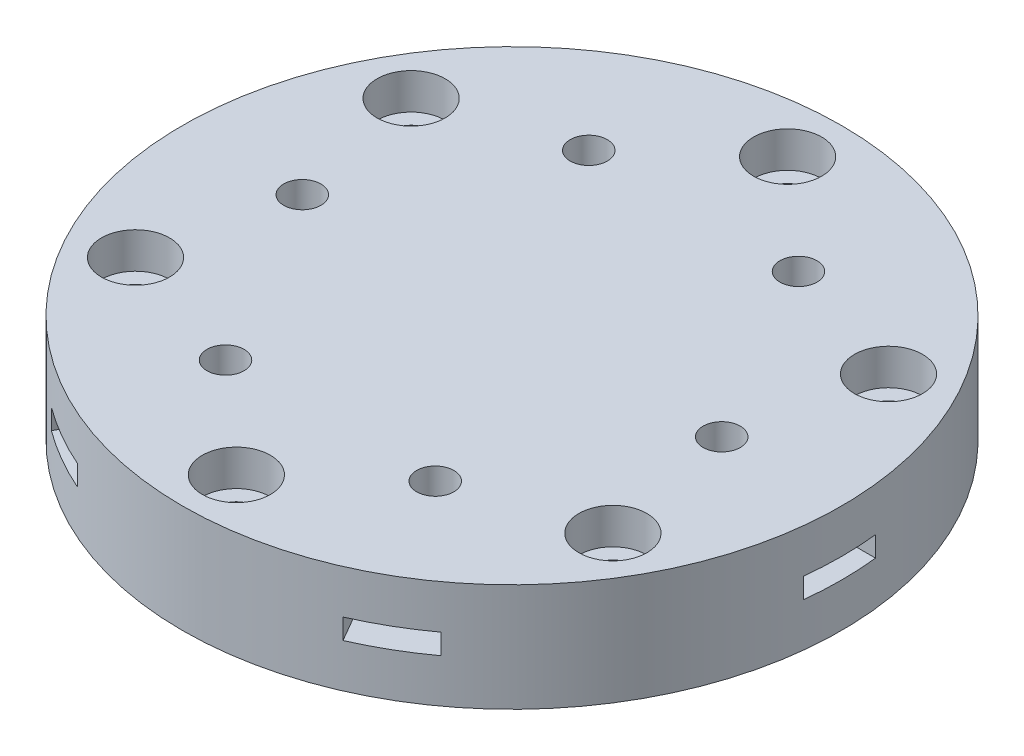
from build123d import *

# Parameters (mm, degrees)
SKETCH1_R           = 27.5
SKETCH1_R_2         = 1.5
BOSS_EXTRUDE1_DEPTH = 9
CUT_EXTRUDE1_START  = -3
SKETCH2_R           = 2.84
SKETCH2_R_2         = 1.5
CUT_EXTRUDE1_DEPTH  = 3
CUT_EXTRUDE2_DEPTH  = 0.85
CUT_EXTRUDE3_REACH  = 41.919
SKETCH5_R           = 1.55


with BuildPart() as part:
    # Sketch1 → Boss-Extrude1 (new body)
    with BuildSketch(Plane(origin=(0, 0, 0), x_dir=(1, 0, 0), z_dir=(0, 1, 0))):
        with Locations(Location((0, 0, 0), (0, 0, 270))):
            Circle(SKETCH1_R)
        with Locations(Location((0, 23, 0), (0, 0, 270))):
            Circle(SKETCH1_R_2, mode=Mode.SUBTRACT)
        with Locations(Location((19.918584287, 11.5, 0), (0, 0, 270))):
            Circle(SKETCH1_R_2, mode=Mode.SUBTRACT)
        with Locations(Location((19.918584287, -11.5, 0), (0, 0, 270))):
            Circle(SKETCH1_R_2, mode=Mode.SUBTRACT)
        with Locations(Location((0, -23, 0), (0, 0, 270))):
            Circle(SKETCH1_R_2, mode=Mode.SUBTRACT)
        with Locations(Location((-19.918584287, -11.5, 0), (0, 0, 270))):
            Circle(SKETCH1_R_2, mode=Mode.SUBTRACT)
        with Locations(Location((-19.918584287, 11.5, 0), (0, 0, 270))):
            Circle(SKETCH1_R_2, mode=Mode.SUBTRACT)
    extrude(amount=BOSS_EXTRUDE1_DEPTH)

    # Sketch2 → Cut-Extrude1 (cut)
    # profile 1 of 6: a face of its own
    with BuildSketch(Plane(origin=(0, 9, 0), x_dir=(1, 0, 0), z_dir=(0, 1, 0)).offset(CUT_EXTRUDE1_START)):
        with Locations(Location((0, -23, 0), (0, 0, 270))):
            Circle(SKETCH2_R)
        with Locations(Location((0, -23, 0), (0, 0, 270))):
            Circle(SKETCH2_R_2, mode=Mode.SUBTRACT)
    # profile 2 of 6: a face of its own
    with BuildSketch(Plane(origin=(0, 9, 0), x_dir=(1, 0, 0), z_dir=(0, 1, 0)).offset(CUT_EXTRUDE1_START)):
        with Locations(Location((-19.918584287, -11.5, 0), (0, 0, 270))):
            Circle(SKETCH2_R)
    # profile 3 of 6: a face of its own
    with BuildSketch(Plane(origin=(0, 9, 0), x_dir=(1, 0, 0), z_dir=(0, 1, 0)).offset(CUT_EXTRUDE1_START)):
        with Locations(Location((-19.918584287, 11.5, 0), (0, 0, 270))):
            Circle(SKETCH2_R)
    # profile 4 of 6: a face of its own
    with BuildSketch(Plane(origin=(0, 9, 0), x_dir=(1, 0, 0), z_dir=(0, 1, 0)).offset(CUT_EXTRUDE1_START)):
        with Locations(Location((0, 23, 0), (0, 0, 270))):
            Circle(SKETCH2_R)
    # profile 5 of 6: a face of its own
    with BuildSketch(Plane(origin=(0, 9, 0), x_dir=(1, 0, 0), z_dir=(0, 1, 0)).offset(CUT_EXTRUDE1_START)):
        with Locations(Location((19.918584287, 11.5, 0), (0, 0, 270))):
            Circle(SKETCH2_R)
    # profile 6 of 6: a face of its own
    with BuildSketch(Plane(origin=(0, 9, 0), x_dir=(1, 0, 0), z_dir=(0, 1, 0)).offset(CUT_EXTRUDE1_START)):
        with Locations(Location((19.918584287, -11.5, 0), (0, 0, 270))):
            Circle(SKETCH2_R)
    extrude(amount=CUT_EXTRUDE1_DEPTH, mode=Mode.SUBTRACT)

    # Sketch4 → Cut-Extrude2 (cut, symmetric)
    with BuildSketch(Plane(origin=(0, 4.5, 0), x_dir=(1, 0, 0), z_dir=(0, 1, 0))):
        with BuildLine():
            Line((20.5, 3), (27.335873866, 3))
            ThreePointArc((27.335873866, 3), (27.5, 0), (27.335873866, -3))
            Line((27.335873866, -3), (20.5, -3))
            Line((20.5, -3), (14.5, -3))
            Line((14.5, -3), (14.5, 3))
            Line((14.5, 3), (20.5, 3))
        make_face()
        with BuildLine():
            Line((9.848076211, -11.057368355), (12.848076211, -16.253520778))
            Line((12.848076211, -16.253520778), (16.266013144, -22.173561202))
            ThreePointArc((16.266013144, -22.173561202), (13.75, -23.815698604), (11.069860721, -25.173561202))
            Line((11.069860721, -25.173561202), (7.651923789, -19.253520778))
            Line((7.651923789, -19.253520778), (4.651923789, -14.057368355))
            Line((4.651923789, -14.057368355), (9.848076211, -11.057368355))
        make_face()
        with BuildLine():
            Line((-4.651923789, -14.057368355), (-7.651923789, -19.253520778))
            Line((-7.651923789, -19.253520778), (-11.069860721, -25.173561202))
            ThreePointArc((-11.069860721, -25.173561202), (-13.75, -23.815698604), (-16.266013144, -22.173561202))
            Line((-16.266013144, -22.173561202), (-12.848076211, -16.253520778))
            Line((-12.848076211, -16.253520778), (-9.848076211, -11.057368355))
            Line((-9.848076211, -11.057368355), (-4.651923789, -14.057368355))
        make_face()
        with BuildLine():
            Line((-14.5, -3), (-20.5, -3))
            Line((-20.5, -3), (-27.335873866, -3))
            ThreePointArc((-27.335873866, -3), (-27.5, 0), (-27.335873866, 3))
            Line((-27.335873866, 3), (-20.5, 3))
            Line((-20.5, 3), (-14.5, 3))
            Line((-14.5, 3), (-14.5, -3))
        make_face()
        with BuildLine():
            Line((-9.848076211, 11.057368355), (-12.848076211, 16.253520778))
            Line((-12.848076211, 16.253520778), (-16.266013144, 22.173561202))
            ThreePointArc((-16.266013144, 22.173561202), (-13.75, 23.815698604), (-11.069860721, 25.173561202))
            Line((-11.069860721, 25.173561202), (-7.651923789, 19.253520778))
            Line((-7.651923789, 19.253520778), (-4.651923789, 14.057368355))
            Line((-4.651923789, 14.057368355), (-9.848076211, 11.057368355))
        make_face()
        with BuildLine():
            Line((4.651923789, 14.057368355), (7.651923789, 19.253520778))
            Line((7.651923789, 19.253520778), (11.069860721, 25.173561202))
            ThreePointArc((11.069860721, 25.173561202), (13.75, 23.815698604), (16.266013144, 22.173561202))
            Line((16.266013144, 22.173561202), (12.848076211, 16.253520778))
            Line((12.848076211, 16.253520778), (9.848076211, 11.057368355))
            Line((9.848076211, 11.057368355), (4.651923789, 14.057368355))
        make_face()
    extrude(amount=CUT_EXTRUDE2_DEPTH, both=True, mode=Mode.SUBTRACT)

    # Sketch5 → Cut-Extrude3 (cut, up to next)
    with BuildSketch(Plane(origin=(0, 9, 0), x_dir=(1, 0, 0), z_dir=(0, 1, 0)), mode=Mode.PRIVATE) as cut_extrude3_sk1:
        with BuildLine():
            ThreePointArc((-16.403984489, 1.096015511), (-17.5, 1.55), (-18.596015511, 1.096015511))
            Line((-18.596015511, 1.096015511), (-17.5, 0))
            Line((-17.5, 0), (-16.403984489, 1.096015511))
        make_face()
    cut_extrude3_tool1 = extrude(cut_extrude3_sk1.sketch, amount=-CUT_EXTRUDE3_REACH, mode=Mode.PRIVATE) & part.part
    # Sketch5 → Cut-Extrude3 (cut, up to next)
    with BuildSketch(Plane(origin=(0, 9, 0), x_dir=(1, 0, 0), z_dir=(0, 1, 0)), mode=Mode.PRIVATE) as cut_extrude3_sk2:
        with BuildLine():
            Line((-17.5, 0), (-18.596015511, 1.096015511))
            ThreePointArc((-18.596015511, 1.096015511), (-19.05, 0), (-18.596015511, -1.096015511))
            Line((-18.596015511, -1.096015511), (-17.5, 0))
        make_face()
    cut_extrude3_tool2 = extrude(cut_extrude3_sk2.sketch, amount=-CUT_EXTRUDE3_REACH, mode=Mode.PRIVATE) & part.part
    # Sketch5 → Cut-Extrude3 (cut, up to next)
    with BuildSketch(Plane(origin=(0, 9, 0), x_dir=(1, 0, 0), z_dir=(0, 1, 0)), mode=Mode.PRIVATE) as cut_extrude3_sk3:
        with BuildLine():
            Line((-16.403984489, 1.096015511), (-17.5, 0))
            Line((-17.5, 0), (-16.403984489, -1.096015511))
            ThreePointArc((-16.403984489, -1.096015511), (-16.067986725, -0.59315932), (-15.95, 0))
            ThreePointArc((-15.95, 0), (-16.067986725, 0.59315932), (-16.403984489, 1.096015511))
        make_face()
    cut_extrude3_tool3 = extrude(cut_extrude3_sk3.sketch, amount=-CUT_EXTRUDE3_REACH, mode=Mode.PRIVATE) & part.part
    # Sketch5 → Cut-Extrude3 (cut, up to next)
    with BuildSketch(Plane(origin=(0, 9, 0), x_dir=(1, 0, 0), z_dir=(0, 1, 0)), mode=Mode.PRIVATE) as cut_extrude3_sk4:
        with BuildLine():
            Line((-16.403984489, -1.096015511), (-17.5, 0))
            Line((-17.5, 0), (-18.596015511, -1.096015511))
            ThreePointArc((-18.596015511, -1.096015511), (-17.5, -1.55), (-16.403984489, -1.096015511))
        make_face()
    cut_extrude3_tool4 = extrude(cut_extrude3_sk4.sketch, amount=-CUT_EXTRUDE3_REACH, mode=Mode.PRIVATE) & part.part
    # Sketch5 → Cut-Extrude3 (cut, up to next)
    with BuildSketch(Plane(origin=(0, 9, 0), x_dir=(1, 0, 0), z_dir=(0, 1, 0)), mode=Mode.PRIVATE) as cut_extrude3_sk5:
        with BuildLine():
            ThreePointArc((-16.403984489, 1.096015511), (-17.5, 1.55), (-18.596015511, 1.096015511))
            Line((-18.596015511, 1.096015511), (-17.5, 0))
            Line((-17.5, 0), (-16.403984489, 1.096015511))
        make_face()
    cut_extrude3_tool5 = extrude(cut_extrude3_sk5.sketch, amount=-CUT_EXTRUDE3_REACH, mode=Mode.PRIVATE) & part.part
    # Sketch5 → Cut-Extrude3 (cut, up to next)
    with BuildSketch(Plane(origin=(0, 9, 0), x_dir=(1, 0, 0), z_dir=(0, 1, 0)), mode=Mode.PRIVATE) as cut_extrude3_sk6:
        with BuildLine():
            Line((-17.5, 0), (-18.596015511, 1.096015511))
            ThreePointArc((-18.596015511, 1.096015511), (-19.05, 0), (-18.596015511, -1.096015511))
            Line((-18.596015511, -1.096015511), (-17.5, 0))
        make_face()
    cut_extrude3_tool6 = extrude(cut_extrude3_sk6.sketch, amount=-CUT_EXTRUDE3_REACH, mode=Mode.PRIVATE) & part.part
    # Sketch5 → Cut-Extrude3 (cut, up to next)
    with BuildSketch(Plane(origin=(0, 9, 0), x_dir=(1, 0, 0), z_dir=(0, 1, 0)), mode=Mode.PRIVATE) as cut_extrude3_sk7:
        with BuildLine():
            Line((-16.403984489, 1.096015511), (-17.5, 0))
            Line((-17.5, 0), (-16.403984489, -1.096015511))
            ThreePointArc((-16.403984489, -1.096015511), (-16.067986725, -0.59315932), (-15.95, 0))
            ThreePointArc((-15.95, 0), (-16.067986725, 0.59315932), (-16.403984489, 1.096015511))
        make_face()
    cut_extrude3_tool7 = extrude(cut_extrude3_sk7.sketch, amount=-CUT_EXTRUDE3_REACH, mode=Mode.PRIVATE) & part.part
    # Sketch5 → Cut-Extrude3 (cut, up to next)
    with BuildSketch(Plane(origin=(0, 9, 0), x_dir=(1, 0, 0), z_dir=(0, 1, 0)), mode=Mode.PRIVATE) as cut_extrude3_sk8:
        with BuildLine():
            Line((-16.403984489, -1.096015511), (-17.5, 0))
            Line((-17.5, 0), (-18.596015511, -1.096015511))
            ThreePointArc((-18.596015511, -1.096015511), (-17.5, -1.55), (-16.403984489, -1.096015511))
        make_face()
    cut_extrude3_tool8 = extrude(cut_extrude3_sk8.sketch, amount=-CUT_EXTRUDE3_REACH, mode=Mode.PRIVATE) & part.part
    # Sketch5 → Cut-Extrude3 (cut, up to next)
    with BuildSketch(Plane(origin=(0, 9, 0), x_dir=(1, 0, 0), z_dir=(0, 1, 0)), mode=Mode.PRIVATE) as cut_extrude3_sk9:
        with BuildLine():
            ThreePointArc((-16.403984489, 1.096015511), (-17.5, 1.55), (-18.596015511, 1.096015511))
            Line((-18.596015511, 1.096015511), (-17.5, 0))
            Line((-17.5, 0), (-16.403984489, 1.096015511))
        make_face()
    cut_extrude3_tool9 = extrude(cut_extrude3_sk9.sketch, amount=-CUT_EXTRUDE3_REACH, mode=Mode.PRIVATE) & part.part
    # Sketch5 → Cut-Extrude3 (cut, up to next)
    with BuildSketch(Plane(origin=(0, 9, 0), x_dir=(1, 0, 0), z_dir=(0, 1, 0)), mode=Mode.PRIVATE) as cut_extrude3_sk10:
        with BuildLine():
            Line((-17.5, 0), (-18.596015511, 1.096015511))
            ThreePointArc((-18.596015511, 1.096015511), (-19.05, 0), (-18.596015511, -1.096015511))
            Line((-18.596015511, -1.096015511), (-17.5, 0))
        make_face()
    cut_extrude3_tool10 = extrude(cut_extrude3_sk10.sketch, amount=-CUT_EXTRUDE3_REACH, mode=Mode.PRIVATE) & part.part
    # Sketch5 → Cut-Extrude3 (cut, up to next)
    with BuildSketch(Plane(origin=(0, 9, 0), x_dir=(1, 0, 0), z_dir=(0, 1, 0)), mode=Mode.PRIVATE) as cut_extrude3_sk11:
        with BuildLine():
            Line((-16.403984489, 1.096015511), (-17.5, 0))
            Line((-17.5, 0), (-16.403984489, -1.096015511))
            ThreePointArc((-16.403984489, -1.096015511), (-16.067986725, -0.59315932), (-15.95, 0))
            ThreePointArc((-15.95, 0), (-16.067986725, 0.59315932), (-16.403984489, 1.096015511))
        make_face()
    cut_extrude3_tool11 = extrude(cut_extrude3_sk11.sketch, amount=-CUT_EXTRUDE3_REACH, mode=Mode.PRIVATE) & part.part
    # Sketch5 → Cut-Extrude3 (cut, up to next)
    with BuildSketch(Plane(origin=(0, 9, 0), x_dir=(1, 0, 0), z_dir=(0, 1, 0)), mode=Mode.PRIVATE) as cut_extrude3_sk12:
        with BuildLine():
            Line((-16.403984489, -1.096015511), (-17.5, 0))
            Line((-17.5, 0), (-18.596015511, -1.096015511))
            ThreePointArc((-18.596015511, -1.096015511), (-17.5, -1.55), (-16.403984489, -1.096015511))
        make_face()
    cut_extrude3_tool12 = extrude(cut_extrude3_sk12.sketch, amount=-CUT_EXTRUDE3_REACH, mode=Mode.PRIVATE) & part.part
    # Sketch5 → Cut-Extrude3 (cut, up to next)
    with BuildSketch(Plane(origin=(0, 9, 0), x_dir=(1, 0, 0), z_dir=(0, 1, 0)), mode=Mode.PRIVATE) as cut_extrude3_sk13:
        with BuildLine():
            ThreePointArc((-16.403984489, 1.096015511), (-17.5, 1.55), (-18.596015511, 1.096015511))
            Line((-18.596015511, 1.096015511), (-17.5, 0))
            Line((-17.5, 0), (-16.403984489, 1.096015511))
        make_face()
    cut_extrude3_tool13 = extrude(cut_extrude3_sk13.sketch, amount=-CUT_EXTRUDE3_REACH, mode=Mode.PRIVATE) & part.part
    # Sketch5 → Cut-Extrude3 (cut, up to next)
    with BuildSketch(Plane(origin=(0, 9, 0), x_dir=(1, 0, 0), z_dir=(0, 1, 0)), mode=Mode.PRIVATE) as cut_extrude3_sk14:
        with BuildLine():
            Line((-17.5, 0), (-18.596015511, 1.096015511))
            ThreePointArc((-18.596015511, 1.096015511), (-19.05, 0), (-18.596015511, -1.096015511))
            Line((-18.596015511, -1.096015511), (-17.5, 0))
        make_face()
    cut_extrude3_tool14 = extrude(cut_extrude3_sk14.sketch, amount=-CUT_EXTRUDE3_REACH, mode=Mode.PRIVATE) & part.part
    # Sketch5 → Cut-Extrude3 (cut, up to next)
    with BuildSketch(Plane(origin=(0, 9, 0), x_dir=(1, 0, 0), z_dir=(0, 1, 0)), mode=Mode.PRIVATE) as cut_extrude3_sk15:
        with BuildLine():
            Line((-16.403984489, 1.096015511), (-17.5, 0))
            Line((-17.5, 0), (-16.403984489, -1.096015511))
            ThreePointArc((-16.403984489, -1.096015511), (-16.067986725, -0.59315932), (-15.95, 0))
            ThreePointArc((-15.95, 0), (-16.067986725, 0.59315932), (-16.403984489, 1.096015511))
        make_face()
    cut_extrude3_tool15 = extrude(cut_extrude3_sk15.sketch, amount=-CUT_EXTRUDE3_REACH, mode=Mode.PRIVATE) & part.part
    # Sketch5 → Cut-Extrude3 (cut, up to next)
    with BuildSketch(Plane(origin=(0, 9, 0), x_dir=(1, 0, 0), z_dir=(0, 1, 0)), mode=Mode.PRIVATE) as cut_extrude3_sk16:
        with BuildLine():
            Line((-16.403984489, -1.096015511), (-17.5, 0))
            Line((-17.5, 0), (-18.596015511, -1.096015511))
            ThreePointArc((-18.596015511, -1.096015511), (-17.5, -1.55), (-16.403984489, -1.096015511))
        make_face()
    cut_extrude3_tool16 = extrude(cut_extrude3_sk16.sketch, amount=-CUT_EXTRUDE3_REACH, mode=Mode.PRIVATE) & part.part
    # Sketch5 → Cut-Extrude3 (cut, up to next)
    with BuildSketch(Plane(origin=(0, 9, 0), x_dir=(1, 0, 0), z_dir=(0, 1, 0)), mode=Mode.PRIVATE) as cut_extrude3_sk17:
        with Locations(Location((-8.75, 15.155444566, 0), (0, 0, 270))):
            Circle(SKETCH5_R)
    cut_extrude3_tool17 = extrude(cut_extrude3_sk17.sketch, amount=-CUT_EXTRUDE3_REACH, mode=Mode.PRIVATE) & part.part
    # Sketch5 → Cut-Extrude3 (cut, up to next)
    with BuildSketch(Plane(origin=(0, 9, 0), x_dir=(1, 0, 0), z_dir=(0, 1, 0)), mode=Mode.PRIVATE) as cut_extrude3_sk18:
        with Locations(Location((8.75, 15.155444566, 0), (0, 0, 270))):
            Circle(SKETCH5_R)
    cut_extrude3_tool18 = extrude(cut_extrude3_sk18.sketch, amount=-CUT_EXTRUDE3_REACH, mode=Mode.PRIVATE) & part.part
    # Sketch5 → Cut-Extrude3 (cut, up to next)
    with BuildSketch(Plane(origin=(0, 9, 0), x_dir=(1, 0, 0), z_dir=(0, 1, 0)), mode=Mode.PRIVATE) as cut_extrude3_sk19:
        with Locations(Location((17.5, 0, 0), (0, 0, 270))):
            Circle(SKETCH5_R)
    cut_extrude3_tool19 = extrude(cut_extrude3_sk19.sketch, amount=-CUT_EXTRUDE3_REACH, mode=Mode.PRIVATE) & part.part
    # Sketch5 → Cut-Extrude3 (cut, up to next)
    with BuildSketch(Plane(origin=(0, 9, 0), x_dir=(1, 0, 0), z_dir=(0, 1, 0)), mode=Mode.PRIVATE) as cut_extrude3_sk20:
        with Locations(Location((8.75, -15.155444566, 0), (0, 0, 270))):
            Circle(SKETCH5_R)
    cut_extrude3_tool20 = extrude(cut_extrude3_sk20.sketch, amount=-CUT_EXTRUDE3_REACH, mode=Mode.PRIVATE) & part.part
    # Sketch5 → Cut-Extrude3 (cut, up to next)
    with BuildSketch(Plane(origin=(0, 9, 0), x_dir=(1, 0, 0), z_dir=(0, 1, 0)), mode=Mode.PRIVATE) as cut_extrude3_sk21:
        with Locations(Location((-8.75, -15.155444566, 0), (0, 0, 270))):
            Circle(SKETCH5_R)
    cut_extrude3_tool21 = extrude(cut_extrude3_sk21.sketch, amount=-CUT_EXTRUDE3_REACH, mode=Mode.PRIVATE) & part.part
    add(cut_extrude3_tool1.solids().sort_by_distance((-17.5, 9, -0.930327))[0], mode=Mode.SUBTRACT)
    add(cut_extrude3_tool2.solids().sort_by_distance((-18.430327, 9, 0))[0], mode=Mode.SUBTRACT)
    add(cut_extrude3_tool3.solids().sort_by_distance((-16.569673, 9, 0))[0], mode=Mode.SUBTRACT)
    add(cut_extrude3_tool4.solids().sort_by_distance((-17.5, 9, 0.930327))[0], mode=Mode.SUBTRACT)
    add(cut_extrude3_tool5.solids().sort_by_distance((-17.5, 9, -0.930327))[0], mode=Mode.SUBTRACT)
    add(cut_extrude3_tool6.solids().sort_by_distance((-18.430327, 9, 0))[0], mode=Mode.SUBTRACT)
    add(cut_extrude3_tool7.solids().sort_by_distance((-16.569673, 9, 0))[0], mode=Mode.SUBTRACT)
    add(cut_extrude3_tool8.solids().sort_by_distance((-17.5, 9, 0.930327))[0], mode=Mode.SUBTRACT)
    add(cut_extrude3_tool9.solids().sort_by_distance((-17.5, 9, -0.930327))[0], mode=Mode.SUBTRACT)
    add(cut_extrude3_tool10.solids().sort_by_distance((-18.430327, 9, 0))[0], mode=Mode.SUBTRACT)
    add(cut_extrude3_tool11.solids().sort_by_distance((-16.569673, 9, 0))[0], mode=Mode.SUBTRACT)
    add(cut_extrude3_tool12.solids().sort_by_distance((-17.5, 9, 0.930327))[0], mode=Mode.SUBTRACT)
    add(cut_extrude3_tool13.solids().sort_by_distance((-17.5, 9, -0.930327))[0], mode=Mode.SUBTRACT)
    add(cut_extrude3_tool14.solids().sort_by_distance((-18.430327, 9, 0))[0], mode=Mode.SUBTRACT)
    add(cut_extrude3_tool15.solids().sort_by_distance((-16.569673, 9, 0))[0], mode=Mode.SUBTRACT)
    add(cut_extrude3_tool16.solids().sort_by_distance((-17.5, 9, 0.930327))[0], mode=Mode.SUBTRACT)
    add(cut_extrude3_tool17.solids().sort_by_distance((-8.75, 9, -15.155445))[0], mode=Mode.SUBTRACT)
    add(cut_extrude3_tool18.solids().sort_by_distance((8.75, 9, -15.155445))[0], mode=Mode.SUBTRACT)
    add(cut_extrude3_tool19.solids().sort_by_distance((17.5, 9, 0))[0], mode=Mode.SUBTRACT)
    add(cut_extrude3_tool20.solids().sort_by_distance((8.75, 9, 15.155445))[0], mode=Mode.SUBTRACT)
    add(cut_extrude3_tool21.solids().sort_by_distance((-8.75, 9, 15.155445))[0], mode=Mode.SUBTRACT)


solid = part.part
